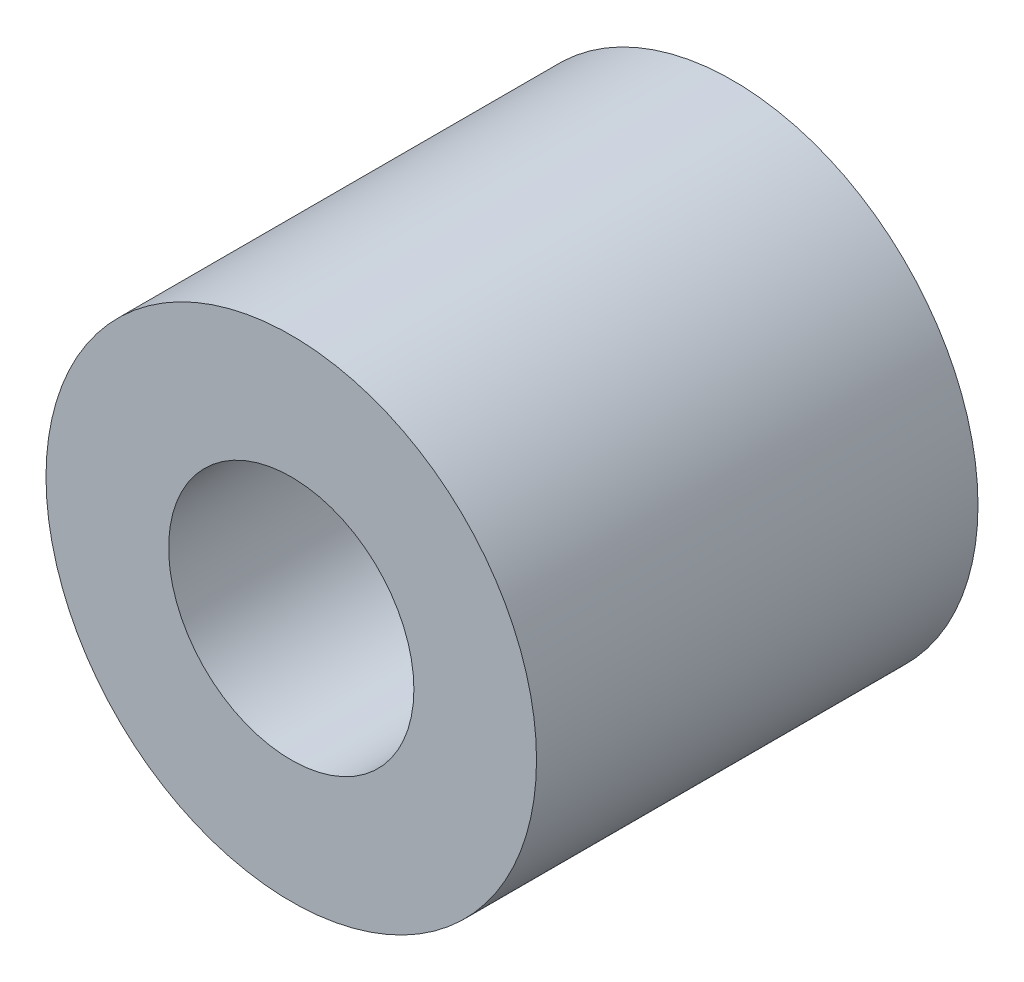
from build123d import *

# Parameters (mm, degrees)
SKETCH_1_R      = 5
SKETCH_1_R_2    = 2.5
EXTRUDE_1_DEPTH = 9


with BuildPart() as part:
    # 草图1 → 凸台-拉伸1 (new body)
    with BuildSketch(Plane.XY):
        Circle(SKETCH_1_R)
        Circle(SKETCH_1_R_2, mode=Mode.SUBTRACT)
    extrude(amount=EXTRUDE_1_DEPTH)


solid = part.part
